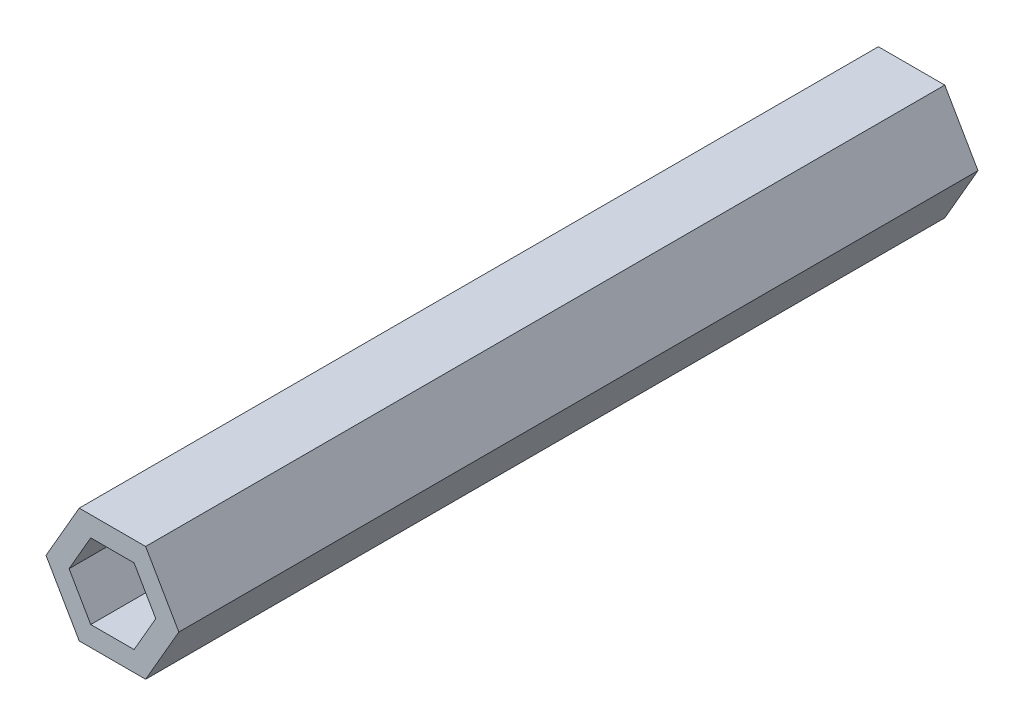
from build123d import *

# Parameters (mm, degrees)
BOSS_EXTRUDE1_DEPTH = 101.6


with BuildPart() as part:
    # Sketch1 → Boss-Extrude1 (new body)
    with BuildSketch(Plane.XY):
        Polygon((-8.443932439, 0), (-4.221966219, -7.31266), (4.221966219, -7.31266), (8.443932439, 0), (4.221966219, 7.31266), (-4.221966219, 7.31266), align=None)
        Polygon((-5.510993072, 0), (-2.755496536, -4.77266), (2.755496536, -4.77266), (5.510993072, 0), (2.755496536, 4.77266), (-2.755496536, 4.77266), align=None, mode=Mode.SUBTRACT)
    extrude(amount=BOSS_EXTRUDE1_DEPTH)


solid = part.part
